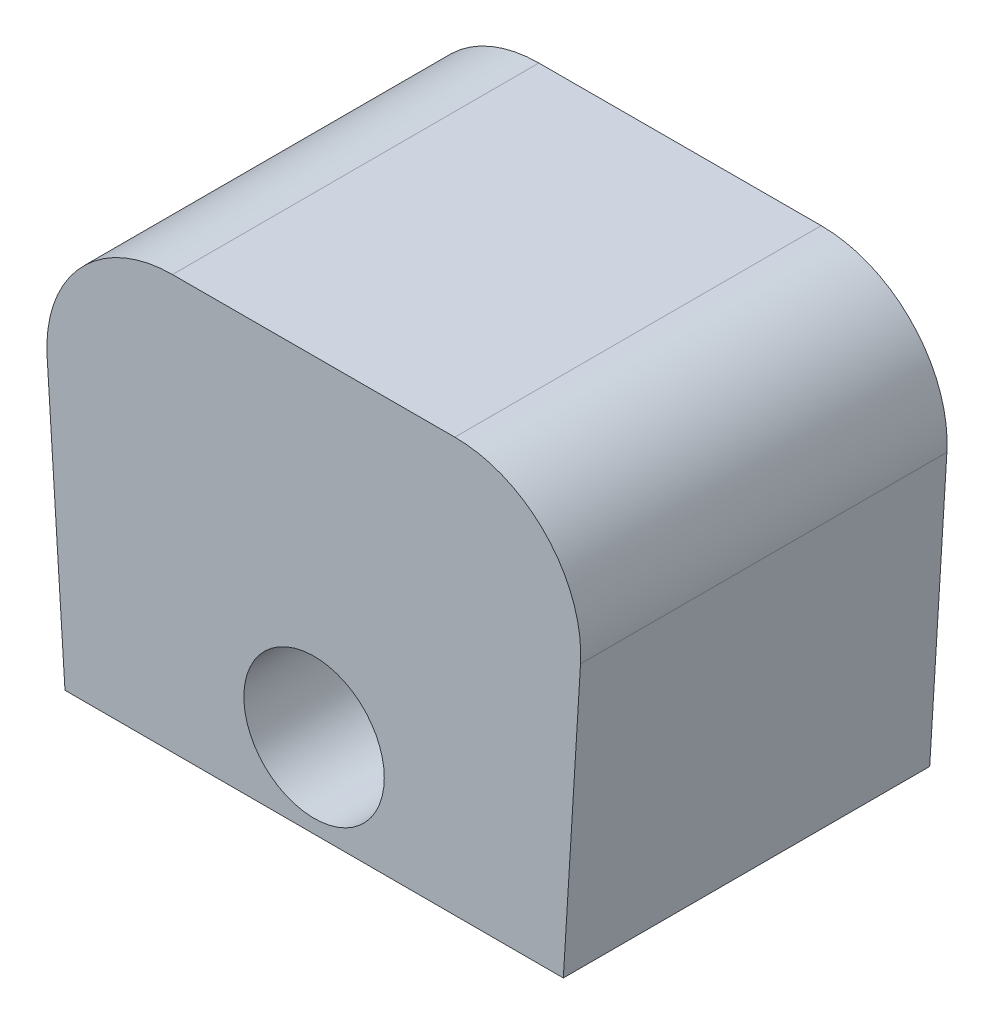
from build123d import *

# Parameters (mm, degrees)
SKETCH2_R           = 2.127
BOSS_EXTRUDE1_DEPTH = 11.0998
SKETCH3_W           = 24.110565092
SKETCH3_H           = 30.85676152
CUT_EXTRUDE1_DEPTH  = 11.0998


with BuildPart() as part:
    # Sketch2 → Boss-Extrude1 (new body)
    with BuildSketch(Plane.XY):
        with BuildLine():
            Line((-5.032244852, -170.140769418), (-3.337033957, -142.465103356))
            ThreePointArc((-3.337033957, -142.465103356), (-4.366318267, -139.620020754), (-7.144640499, -138.422169855))
            Line((-7.144640499, -138.422169855), (-15.698665552, -138.4327981))
            ThreePointArc((-15.698665552, -138.4327981), (-18.474002587, -139.637549336), (-19.496213787, -142.48518089))
            Line((-19.496213787, -142.48518089), (-17.732235049, -170.156548962))
            ThreePointArc((-17.732235049, -170.156548962), (-11.374511927, -176.368472831), (-5.032244852, -170.140769418))
        make_face()
        with Locations((-11.409226923, -148.428494397)):
            Circle(SKETCH2_R, mode=Mode.SUBTRACT)
        with Locations((-11.380823745, -171.288476752)):
            Circle(SKETCH2_R, mode=Mode.SUBTRACT)
    extrude(amount=BOSS_EXTRUDE1_DEPTH)

    # Sketch3 → Cut-Extrude1 (cut)
    with BuildSketch(Plane.XY.offset(11.0998)):
        with Locations((-9.740364604, -166.396875157)):
            Rectangle(SKETCH3_W, SKETCH3_H)
    extrude(amount=-CUT_EXTRUDE1_DEPTH, mode=Mode.SUBTRACT)


solid = part.part
